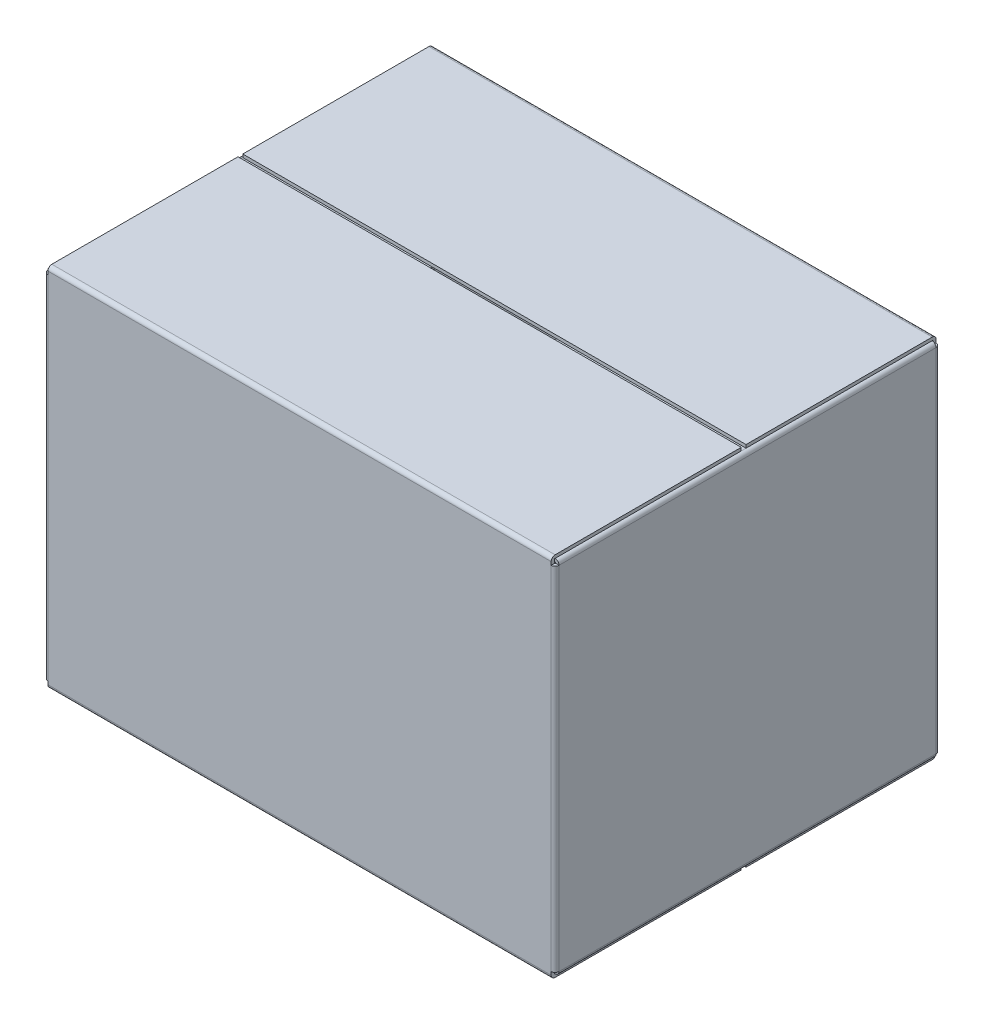
from build123d import *

# Parameters (mm, degrees)
EXTRUDE1_DEPTH      = 177.8
CUT_EXTRUDE1_DEPTH  = 0.79375
CUT_EXTRUDE2_START  = -0.79375
CUT_EXTRUDE2_DEPTH  = 0.79375
EXTRUDE2_DEPTH      = 189.70625
EXTRUDE2_DEPTH_BACK = 189.70625
EXTRUDE3_DEPTH      = 253.20625
EXTRUDE3_DEPTH_BACK = 253.20625
CUT_EXTRUDE3_DEPTH  = 0.00254
SCALE1_SCALE        = 0.5
SCALE2_SCALE        = 0.9
SCALE3_SCALE        = 0.5
SCALE4_SCALE        = 0.5
SCALE5_SCALE        = 0.2
SCALE6_SCALE        = 3
SCALE7_SCALE        = 0.75


with BuildPart() as part:
    # Sketch1 → Extrude1 (new, symmetric)
    with BuildSketch(Plane(origin=(0, 0, 0), x_dir=(1, 0, 0), z_dir=(0, 1, 0))):
        with BuildLine():
            Line((257.175, -189.70625), (257.175, 189.70625))
            ThreePointArc((257.175, 189.70625), (256.012580038, 192.512580038), (253.20625, 193.675))
            Line((253.20625, 193.675), (-253.20625, 193.675))
            ThreePointArc((-253.20625, 193.675), (-256.012580038, 192.512580038), (-257.175, 189.70625))
            Line((-257.175, 189.70625), (-257.175, -189.70625))
            ThreePointArc((-257.175, -189.70625), (-256.012580038, -192.512580038), (-253.20625, -193.675))
            Line((-253.20625, -193.675), (253.20625, -193.675))
            ThreePointArc((253.20625, -193.675), (256.012580038, -192.512580038), (257.175, -189.70625))
        make_face()
        with BuildLine():
            Line((-253.20625, -190.5), (253.20625, -190.5))
            ThreePointArc((253.20625, -190.5), (253.767516008, -190.267516008), (254, -189.70625))
            Line((254, -189.70625), (254, 189.70625))
            ThreePointArc((254, 189.70625), (253.767516008, 190.267516008), (253.20625, 190.5))
            Line((253.20625, 190.5), (-253.20625, 190.5))
            ThreePointArc((-253.20625, 190.5), (-253.767516008, 190.267516008), (-254, 189.70625))
            Line((-254, 189.70625), (-254, -189.70625))
            ThreePointArc((-254, -189.70625), (-253.767516008, -190.267516008), (-253.20625, -190.5))
        make_face(mode=Mode.SUBTRACT)
    extrude(amount=EXTRUDE1_DEPTH, both=True)

    # Sketch2 → Cut-Extrude1 (cut)
    with BuildSketch(Plane(origin=(0, 177.8, 0), x_dir=(1, 0, 0), z_dir=(0, 1, 0))):
        with BuildLine():
            Line((257.175, -189.70625), (257.175, 189.70625))
            ThreePointArc((257.175, 189.70625), (256.012580038, 192.512580038), (253.20625, 193.675))
            Line((253.20625, 193.675), (-253.20625, 193.675))
            ThreePointArc((-253.20625, 193.675), (-256.012580038, 192.512580038), (-257.175, 189.70625))
            Line((-257.175, 189.70625), (-257.175, -189.70625))
            ThreePointArc((-257.175, -189.70625), (-256.012580038, -192.512580038), (-253.20625, -193.675))
            Line((-253.20625, -193.675), (253.20625, -193.675))
            ThreePointArc((253.20625, -193.675), (256.012580038, -192.512580038), (257.175, -189.70625))
        make_face()
    extrude(amount=-CUT_EXTRUDE1_DEPTH, mode=Mode.SUBTRACT)

    # Sketch3 → Cut-Extrude2 (cut)
    with BuildSketch(Plane.XZ.offset(177.8).offset(CUT_EXTRUDE2_START)):
        with BuildLine():
            Line((253.20625, 193.675), (-253.20625, 193.675))
            ThreePointArc((-253.20625, 193.675), (-256.012580038, 192.512580038), (-257.175, 189.70625))
            Line((-257.175, 189.70625), (-257.175, -189.70625))
            ThreePointArc((-257.175, -189.70625), (-256.012580038, -192.512580038), (-253.20625, -193.675))
            Line((-253.20625, -193.675), (253.20625, -193.675))
            ThreePointArc((253.20625, -193.675), (256.012580038, -192.512580038), (257.175, -189.70625))
            Line((257.175, -189.70625), (257.175, 189.70625))
            ThreePointArc((257.175, 189.70625), (256.012580038, 192.512580038), (253.20625, 193.675))
        make_face()
    extrude(amount=CUT_EXTRUDE2_DEPTH, mode=Mode.SUBTRACT)

    # Sketch4 → Extrude2 (add, two sides: drawn at the far end of the back side and taken through both)
    with BuildSketch(Plane.XY.offset(-EXTRUDE2_DEPTH_BACK)):
        with BuildLine():
            Line((-257.175, 177.00625), (-254, 177.00625))
            ThreePointArc((-254, 177.00625), (-253.767516008, 177.567516008), (-253.20625, 177.8))
            Line((-253.20625, 177.8), (-62.70625, 177.8))
            Line((-62.70625, 177.8), (-62.70625, 180.975))
            Line((-62.70625, 180.975), (-253.20625, 180.975))
            ThreePointArc((-253.20625, 180.975), (-256.012580038, 179.812580038), (-257.175, 177.00625))
        make_face()
        with BuildLine():
            Line((62.70625, 177.8), (62.70625, 180.975))
            Line((62.70625, 180.975), (253.20625, 180.975))
            ThreePointArc((253.20625, 180.975), (256.012580038, 179.812580038), (257.175, 177.00625))
            Line((257.175, 177.00625), (254, 177.00625))
            ThreePointArc((254, 177.00625), (253.767516008, 177.567516008), (253.20625, 177.8))
            Line((253.20625, 177.8), (62.70625, 177.8))
        make_face()
        with BuildLine():
            Line((257.175, -177.00625), (254, -177.00625))
            ThreePointArc((254, -177.00625), (253.767516008, -177.567516008), (253.20625, -177.8))
            Line((253.20625, -177.8), (62.70625, -177.8))
            Line((62.70625, -177.8), (62.70625, -180.975))
            Line((62.70625, -180.975), (253.20625, -180.975))
            ThreePointArc((253.20625, -180.975), (256.012580038, -179.812580038), (257.175, -177.00625))
        make_face()
        with BuildLine():
            Line((-62.70625, -177.8), (-62.70625, -180.975))
            Line((-62.70625, -180.975), (-253.20625, -180.975))
            ThreePointArc((-253.20625, -180.975), (-256.012580038, -179.812580038), (-257.175, -177.00625))
            Line((-257.175, -177.00625), (-254, -177.00625))
            ThreePointArc((-254, -177.00625), (-253.767516008, -177.567516008), (-253.20625, -177.8))
            Line((-253.20625, -177.8), (-62.70625, -177.8))
        make_face()
    extrude(amount=EXTRUDE2_DEPTH + EXTRUDE2_DEPTH_BACK)

    # Sketch5 → Extrude3 (add, two sides: drawn at the far end of the back side and taken through both)
    with BuildSketch(Plane(origin=(0, 0, 0), x_dir=(0, 0, -1), z_dir=(1, 0, 0)).offset(-EXTRUDE3_DEPTH_BACK)):
        with BuildLine():
            Line((-193.675, 177.00625), (-190.5, 177.00625))
            Line((-190.5, 177.00625), (-190.5, 180.20665))
            ThreePointArc((-190.5, 180.20665), (-190.267516008, 180.767916008), (-189.70625, 181.0004))
            Line((-189.70625, 181.0004), (-2.40665, 181.0004))
            Line((-2.40665, 181.0004), (-2.40665, 184.1754))
            Line((-2.40665, 184.1754), (-189.70625, 184.1754))
            ThreePointArc((-189.70625, 184.1754), (-192.512580038, 183.012980038), (-193.675, 180.20665))
            Line((-193.675, 180.20665), (-193.675, 177.00625))
        make_face()
        with BuildLine():
            Line((2.40665, 181.0004), (2.40665, 184.1754))
            Line((2.40665, 184.1754), (189.70625, 184.1754))
            ThreePointArc((189.70625, 184.1754), (192.512580038, 183.012980038), (193.675, 180.20665))
            Line((193.675, 180.20665), (193.675, 177.00625))
            Line((193.675, 177.00625), (190.5, 177.00625))
            Line((190.5, 177.00625), (190.5, 180.20665))
            ThreePointArc((190.5, 180.20665), (190.267516008, 180.767916008), (189.70625, 181.0004))
            Line((189.70625, 181.0004), (2.40665, 181.0004))
        make_face()
        with BuildLine():
            Line((193.675, -177.00625), (190.5, -177.00625))
            Line((190.5, -177.00625), (190.5, -180.20665))
            ThreePointArc((190.5, -180.20665), (190.267516008, -180.767916008), (189.70625, -181.0004))
            Line((189.70625, -181.0004), (2.40665, -181.0004))
            Line((2.40665, -181.0004), (2.40665, -184.1754))
            Line((2.40665, -184.1754), (189.70625, -184.1754))
            ThreePointArc((189.70625, -184.1754), (192.512580038, -183.012980038), (193.675, -180.20665))
            Line((193.675, -180.20665), (193.675, -177.00625))
        make_face()
        with BuildLine():
            Line((-2.40665, -181.0004), (-2.40665, -184.1754))
            Line((-2.40665, -184.1754), (-189.70625, -184.1754))
            ThreePointArc((-189.70625, -184.1754), (-192.512580038, -183.012980038), (-193.675, -180.20665))
            Line((-193.675, -180.20665), (-193.675, -177.00625))
            Line((-193.675, -177.00625), (-190.5, -177.00625))
            Line((-190.5, -177.00625), (-190.5, -180.20665))
            ThreePointArc((-190.5, -180.20665), (-190.267516008, -180.767916008), (-189.70625, -181.0004))
            Line((-189.70625, -181.0004), (-2.40665, -181.0004))
        make_face()
    extrude(amount=EXTRUDE3_DEPTH + EXTRUDE3_DEPTH_BACK)

    # Sketch6 → Cut-Extrude3 (cut)
    # profile 1 of 9: a face of its own
    with BuildSketch(Plane.XZ.offset(184.1754)):
        Polygon((-53.463701299, -34.15665), (-53.463701299, -30.198208442), (-59.896168831, -30.198208442), (-59.896168831, -26.993571672), (-53.07713474, -15.10665), (-50.49487013, -15.10665), (-50.49487013, -26.981974675), (-48.515649351, -26.981974675), (-48.515649351, -30.198208442), (-50.49487013, -30.198208442), (-50.49487013, -34.15665), align=None)
        Polygon((-53.463701299, -26.981974675), (-53.463701299, -20.584298133), (-57.070367289, -26.981974675), align=None, mode=Mode.SUBTRACT)
    # profile 2 of 9: a face of its own
    with BuildSketch(Plane.XZ.offset(184.1754)):
        with BuildLine():
            add(Edge.make_bspline(
                [(-40.754939123, -15.10665), (-40.570213815, -15.113439719), (-40.205710774, -15.126837305), (-39.673890769, -15.229837619), (-39.16759988, -15.397175732), (-38.690336025, -15.634564912), (-38.241807619, -15.940319252), (-37.820887787, -16.312573778), (-37.427246646, -16.751168966), (-37.058352638, -17.260041231), (-36.726852287, -17.855192892), (-36.443728617, -18.547334171), (-36.205951404, -19.338854827), (-36.012197536, -20.229658899), (-35.858498426, -21.221012003), (-35.754411409, -22.313004996), (-35.688142013, -23.504633185), (-35.6797945, -24.332609546), (-35.675454545, -24.76308263)],
                knots=[0, 0, 0, 0, 0.727503026, 1.435521033, 2.125933754, 2.823035237, 3.52857293, 4.258887692, 5.031802202, 5.846339271, 6.730577678, 7.709342118, 8.787052798, 9.983216815, 11.298799232, 12.737663191, 14.303878888, 16, 16, 16, 16], degree=3))
            add(Edge.make_bspline(
                [(-35.675454545, -24.76308263), (-35.679804001, -25.19226537), (-35.688168807, -26.017662946), (-35.754290314, -27.205457565), (-35.858961902, -28.29476851), (-36.011412411, -29.283818667), (-36.207491687, -30.173977699), (-36.441916756, -30.965330041), (-36.728001686, -31.656291243), (-37.057995192, -32.250921682), (-37.427573619, -32.75810723), (-37.816928404, -33.199337716), (-38.238059523, -33.570367504), (-38.685731216, -33.874972989), (-39.160661677, -34.11458922), (-39.663898252, -34.27951438), (-40.192649551, -34.384617762), (-40.554706834, -34.39748568), (-40.739476461, -34.404052597)],
                knots=[0, 0, 0, 0, 1.695059366, 3.259911835, 4.697127445, 6.015833273, 7.209868934, 8.295006778, 9.271397414, 10.15773515, 10.974206064, 11.745554658, 12.477603308, 13.184816065, 13.879016739, 14.571068615, 15.270769761, 16, 16, 16, 16], degree=3))
            add(Edge.make_bspline(
                [(-40.739476461, -34.404052597), (-40.924123079, -34.396829155), (-41.288235032, -34.382584964), (-41.820957697, -34.285911247), (-42.326881985, -34.117245621), (-42.802950964, -33.879646109), (-43.25263977, -33.578516507), (-43.673344606, -33.209770375), (-44.067516895, -32.775405993), (-44.367181725, -32.362029715), (-44.592508841, -31.996567754), (-44.749696096, -31.690886587), (-44.8962012, -31.359822775), (-45.037218995, -31.005246866), (-45.158055902, -30.620221885), (-45.274627597, -30.212049593), (-45.37927173, -29.777456024), (-45.469564467, -29.317788043), (-45.557859678, -28.834015634), (-45.623490762, -28.322595423), (-45.68843138, -27.787020617), (-45.731523226, -27.223216721), (-45.771868975, -26.635740381), (-45.796724509, -26.020847658), (-45.819044938, -25.381748378), (-45.81898933, -24.946079677), (-45.818961039, -24.724425974)],
                knots=[0, 0, 0, 0, 1.088325032, 2.146111092, 3.178950023, 4.221795161, 5.273015815, 6.360545385, 7.511177693, 8.723556364, 9.364476831, 10.040531105, 10.747741516, 11.498134997, 12.288409729, 13.125171687, 14.000253567, 14.922333743, 15.886381247, 16.898284178, 17.961049106, 19.066181515, 20.23079341, 21.432081124, 22.693528529, 24, 24, 24, 24], degree=3))
            add(Edge.make_bspline(
                [(-45.818961039, -24.724425974), (-45.814624189, -24.296529395), (-45.80628461, -23.473702547), (-45.740018957, -22.289796723), (-45.635983662, -21.205518181), (-45.481989927, -20.220624943), (-45.28773748, -19.333908442), (-45.051694198, -18.544329196), (-44.766490572, -17.854388781), (-44.436402382, -17.259786218), (-44.066846344, -16.752594079), (-43.677486099, -16.3113652), (-43.256356334, -15.940335013), (-42.808684298, -15.635729629), (-42.333753926, -15.396113372), (-41.830517327, -15.231188219), (-41.301766035, -15.126084835), (-40.939708751, -15.113216917), (-40.754939123, -15.10665)],
                knots=[0, 0, 0, 0, 1.69316225, 3.255878705, 4.690734649, 6.001855936, 7.198146525, 8.280455951, 9.258690493, 10.146702072, 10.964714887, 11.737520167, 12.470951286, 13.179499609, 13.875011277, 14.568370088, 15.269392615, 16, 16, 16, 16], degree=3))
        make_face()
        with BuildLine():
            add(Edge.make_bspline(
                [(-40.747207792, -18.075481169), (-40.81586281, -18.079430076), (-40.952723201, -18.087302029), (-41.151753695, -18.143764517), (-41.34113518, -18.233598401), (-41.517275834, -18.364351037), (-41.678953118, -18.53428757), (-41.834209207, -18.735833596), (-41.976962645, -18.974813246), (-42.11402956, -19.257093676), (-42.230507156, -19.611561254), (-42.333081853, -20.053630124), (-42.413774059, -20.595517785), (-42.481293706, -21.236653428), (-42.539950228, -21.976422127), (-42.575480866, -22.817073491), (-42.599003865, -23.756583703), (-42.601444929, -24.416443876), (-42.602727273, -24.76308263)],
                knots=[0, 0, 0, 0, 0.441180509, 0.879471584, 1.320574249, 1.783035872, 2.281174677, 2.824866155, 3.41612178, 4.06851155, 4.839013556, 5.809909241, 6.984378085, 8.359905701, 9.955928005, 11.756194428, 13.770637572, 16, 16, 16, 16], degree=3))
            add(Edge.make_bspline(
                [(-42.602727273, -24.76308263), (-42.601468062, -25.109722424), (-42.599075714, -25.768296381), (-42.575329699, -26.706506071), (-42.540242905, -27.54461502), (-42.480694446, -28.284297816), (-42.414482069, -28.92429187), (-42.332709206, -29.466061067), (-42.23028581, -29.906760213), (-42.11507657, -30.260551739), (-41.975983573, -30.540606589), (-41.83406873, -30.778541726), (-41.680302525, -30.980343648), (-41.5159223, -31.146294483), (-41.341286793, -31.277254353), (-41.151714366, -31.36689913), (-40.952733082, -31.423410355), (-40.815866111, -31.43127579), (-40.747207792, -31.435221429)],
                knots=[0, 0, 0, 0, 2.233529834, 4.243438314, 6.047070022, 7.637798311, 9.024151416, 10.192614236, 11.165324842, 11.937267167, 12.583397913, 13.175758788, 13.720466603, 14.213631053, 14.676957167, 15.118884396, 15.557994781, 16, 16, 16, 16], degree=3))
            add(Edge.make_bspline(
                [(-40.747207792, -31.435221429), (-40.677263187, -31.431357691), (-40.539107813, -31.423725994), (-40.338657361, -31.367116906), (-40.149005063, -31.275941879), (-39.969442705, -31.147933423), (-39.809398192, -30.976355523), (-39.650589477, -30.77962119), (-39.514653074, -30.538272798), (-39.376297801, -30.257719534), (-39.259071854, -29.90344821), (-39.163929448, -29.459922901), (-39.074809593, -28.919624689), (-39.009033194, -28.279244106), (-38.955654023, -27.540559709), (-38.918617135, -26.702669484), (-38.895510123, -25.765710374), (-38.893004708, -25.108430805), (-38.891688312, -24.76308263)],
                knots=[0, 0, 0, 0, 0.450046871, 0.888937661, 1.330643888, 1.800456046, 2.299276457, 2.837157917, 3.424961576, 4.078244013, 4.849800298, 5.820145492, 6.997538181, 8.374947934, 9.964252522, 11.766982255, 13.775885602, 16, 16, 16, 16], degree=3))
            add(Edge.make_bspline(
                [(-38.891688312, -24.76308263), (-38.893015097, -24.416446455), (-38.89554076, -23.756591192), (-38.91849617, -22.817048039), (-38.955847304, -21.976599532), (-39.008826095, -21.236598506), (-39.074822194, -20.594941875), (-39.163937025, -20.05465354), (-39.259042337, -19.611096797), (-39.376379836, -19.256912214), (-39.51440713, -18.976105382), (-39.651885809, -18.734672693), (-39.80810206, -18.534627735), (-39.969587748, -18.362881793), (-40.148969714, -18.234733271), (-40.338666468, -18.143592762), (-40.539105475, -18.086974788), (-40.677262401, -18.079344296), (-40.747207792, -18.075481169)],
                knots=[0, 0, 0, 0, 2.228036839, 4.241282185, 6.040478161, 7.634927745, 9.009637465, 10.184722199, 11.153165298, 11.923209159, 12.575211015, 13.161862447, 13.705230643, 14.203073253, 14.671964473, 15.112804857, 15.550835322, 16, 16, 16, 16], degree=3))
        make_face(mode=Mode.SUBTRACT)
    # profile 3 of 9: a face of its own
    with BuildSketch(Plane.XZ.offset(184.1754)):
        with BuildLine():
            add(Edge.make_bspline(
                [(-27.172536526, -15.10665), (-26.987811218, -15.113439719), (-26.623308177, -15.126837305), (-26.091488171, -15.229837619), (-25.585197282, -15.397175732), (-25.107933428, -15.634564912), (-24.659405022, -15.940319252), (-24.23848519, -16.312573778), (-23.844844049, -16.751168966), (-23.475950041, -17.260041231), (-23.144449689, -17.855192892), (-22.861326019, -18.547334171), (-22.623548807, -19.338854827), (-22.429794939, -20.229658899), (-22.276095829, -21.221012003), (-22.172008811, -22.313004996), (-22.105739415, -23.504633185), (-22.097391902, -24.332609546), (-22.093051948, -24.76308263)],
                knots=[0, 0, 0, 0, 0.727503026, 1.435521033, 2.125933754, 2.823035237, 3.52857293, 4.258887692, 5.031802202, 5.846339271, 6.730577678, 7.709342118, 8.787052798, 9.983216815, 11.298799232, 12.737663191, 14.303878888, 16, 16, 16, 16], degree=3))
            add(Edge.make_bspline(
                [(-22.093051948, -24.76308263), (-22.097401404, -25.19226537), (-22.105766209, -26.017662946), (-22.171887717, -27.205457565), (-22.276559304, -28.29476851), (-22.429009813, -29.283818667), (-22.625089089, -30.173977699), (-22.859514159, -30.965330041), (-23.145599089, -31.656291243), (-23.475592595, -32.250921682), (-23.845171022, -32.75810723), (-24.234525807, -33.199337716), (-24.655656925, -33.570367504), (-25.103328618, -33.874972989), (-25.578259079, -34.11458922), (-26.081495655, -34.27951438), (-26.610246953, -34.384617762), (-26.972304237, -34.39748568), (-27.157073864, -34.404052597)],
                knots=[0, 0, 0, 0, 1.695059366, 3.259911835, 4.697127445, 6.015833273, 7.209868934, 8.295006778, 9.271397414, 10.15773515, 10.974206064, 11.745554658, 12.477603308, 13.184816065, 13.879016739, 14.571068615, 15.270769761, 16, 16, 16, 16], degree=3))
            add(Edge.make_bspline(
                [(-27.157073864, -34.404052597), (-27.341720481, -34.396829155), (-27.705832435, -34.382584964), (-28.2385551, -34.285911247), (-28.744479388, -34.117245621), (-29.220548366, -33.879646109), (-29.670237172, -33.578516507), (-30.090942008, -33.209770375), (-30.485114297, -32.775405993), (-30.784779127, -32.362029715), (-31.010106244, -31.996567754), (-31.167293498, -31.690886587), (-31.313798603, -31.359822775), (-31.454816398, -31.005246866), (-31.575653305, -30.620221885), (-31.692224999, -30.212049593), (-31.796869133, -29.777456024), (-31.88716187, -29.317788043), (-31.975457081, -28.834015634), (-32.041088164, -28.322595423), (-32.106028783, -27.787020617), (-32.149120628, -27.223216721), (-32.189466378, -26.635740381), (-32.214321911, -26.020847658), (-32.23664234, -25.381748378), (-32.236586733, -24.946079677), (-32.236558442, -24.724425974)],
                knots=[0, 0, 0, 0, 1.088325032, 2.146111092, 3.178950023, 4.221795161, 5.273015815, 6.360545385, 7.511177693, 8.723556364, 9.364476831, 10.040531105, 10.747741516, 11.498134997, 12.288409729, 13.125171687, 14.000253567, 14.922333743, 15.886381247, 16.898284178, 17.961049106, 19.066181515, 20.23079341, 21.432081124, 22.693528529, 24, 24, 24, 24], degree=3))
            add(Edge.make_bspline(
                [(-32.236558442, -24.724425974), (-32.232221591, -24.296529395), (-32.223882013, -23.473702547), (-32.15761636, -22.289796723), (-32.053581064, -21.205518181), (-31.899587329, -20.220624943), (-31.705334882, -19.333908442), (-31.4692916, -18.544329196), (-31.184087974, -17.854388781), (-30.853999785, -17.259786218), (-30.484443747, -16.752594079), (-30.095083501, -16.3113652), (-29.673953737, -15.940335013), (-29.226281701, -15.635729629), (-28.751351329, -15.396113372), (-28.24811473, -15.231188219), (-27.719363438, -15.126084835), (-27.357306153, -15.113216917), (-27.172536526, -15.10665)],
                knots=[0, 0, 0, 0, 1.69316225, 3.255878705, 4.690734649, 6.001855936, 7.198146525, 8.280455951, 9.258690493, 10.146702072, 10.964714887, 11.737520167, 12.470951286, 13.179499609, 13.875011277, 14.568370088, 15.269392615, 16, 16, 16, 16], degree=3))
        make_face()
        with BuildLine():
            add(Edge.make_bspline(
                [(-27.164805195, -18.075481169), (-27.233460212, -18.079430076), (-27.370320603, -18.087302029), (-27.569351098, -18.143764517), (-27.758732582, -18.233598401), (-27.934873236, -18.364351037), (-28.09655052, -18.53428757), (-28.251806609, -18.735833596), (-28.394560048, -18.974813246), (-28.531626963, -19.257093676), (-28.648104558, -19.611561254), (-28.750679256, -20.053630124), (-28.831371462, -20.595517785), (-28.898891109, -21.236653428), (-28.957547631, -21.976422127), (-28.993078269, -22.817073491), (-29.016601268, -23.756583703), (-29.019042332, -24.416443876), (-29.020324675, -24.76308263)],
                knots=[0, 0, 0, 0, 0.441180509, 0.879471584, 1.320574249, 1.783035872, 2.281174677, 2.824866155, 3.41612178, 4.06851155, 4.839013556, 5.809909241, 6.984378085, 8.359905701, 9.955928005, 11.756194428, 13.770637572, 16, 16, 16, 16], degree=3))
            add(Edge.make_bspline(
                [(-29.020324675, -24.76308263), (-29.019065465, -25.109722424), (-29.016673117, -25.768296381), (-28.992927101, -26.706506071), (-28.957840308, -27.54461502), (-28.898291849, -28.284297816), (-28.832079472, -28.92429187), (-28.750306608, -29.466061067), (-28.647883212, -29.906760213), (-28.532673972, -30.260551739), (-28.393580976, -30.540606589), (-28.251666133, -30.778541726), (-28.097899927, -30.980343648), (-27.933519703, -31.146294483), (-27.758884196, -31.277254353), (-27.569311769, -31.36689913), (-27.370330485, -31.423410355), (-27.233463513, -31.43127579), (-27.164805195, -31.435221429)],
                knots=[0, 0, 0, 0, 2.233529834, 4.243438314, 6.047070022, 7.637798311, 9.024151416, 10.192614236, 11.165324842, 11.937267167, 12.583397913, 13.175758788, 13.720466603, 14.213631053, 14.676957167, 15.118884396, 15.557994781, 16, 16, 16, 16], degree=3))
            add(Edge.make_bspline(
                [(-27.164805195, -31.435221429), (-27.09486059, -31.431357691), (-26.956705216, -31.423725994), (-26.756254764, -31.367116906), (-26.566602466, -31.275941879), (-26.387040108, -31.147933423), (-26.226995595, -30.976355523), (-26.06818688, -30.77962119), (-25.932250476, -30.538272798), (-25.793895204, -30.257719534), (-25.676669257, -29.90344821), (-25.581526851, -29.459922901), (-25.492406996, -28.919624689), (-25.426630596, -28.279244106), (-25.373251425, -27.540559709), (-25.336214538, -26.702669484), (-25.313107526, -25.765710374), (-25.310602111, -25.108430805), (-25.309285714, -24.76308263)],
                knots=[0, 0, 0, 0, 0.450046871, 0.888937661, 1.330643888, 1.800456046, 2.299276457, 2.837157917, 3.424961576, 4.078244013, 4.849800298, 5.820145492, 6.997538181, 8.374947934, 9.964252522, 11.766982255, 13.775885602, 16, 16, 16, 16], degree=3))
            add(Edge.make_bspline(
                [(-25.309285714, -24.76308263), (-25.310612499, -24.416446455), (-25.313138163, -23.756591192), (-25.336093573, -22.817048039), (-25.373444706, -21.976599532), (-25.426423498, -21.236598506), (-25.492419597, -20.594941875), (-25.581534427, -20.05465354), (-25.676639739, -19.611096797), (-25.793977238, -19.256912214), (-25.932004532, -18.976105382), (-26.069483211, -18.734672693), (-26.225699462, -18.534627735), (-26.387185151, -18.362881793), (-26.566567117, -18.234733271), (-26.75626387, -18.143592762), (-26.956702877, -18.086974788), (-27.094859804, -18.079344296), (-27.164805195, -18.075481169)],
                knots=[0, 0, 0, 0, 2.228036839, 4.241282185, 6.040478161, 7.634927745, 9.009637465, 10.184722199, 11.153165298, 11.923209159, 12.575211015, 13.161862447, 13.705230643, 14.203073253, 14.671964473, 15.112804857, 15.550835322, 16, 16, 16, 16], degree=3))
        make_face(mode=Mode.SUBTRACT)
    # profile 4 of 9: a face of its own
    with BuildSketch(Plane.XZ.offset(184.1754)):
        with BuildLine():
            add(Edge.make_bspline(
                [(-13.590133929, -15.10665), (-13.40540862, -15.113439719), (-13.040905579, -15.126837305), (-12.509085574, -15.229837619), (-12.002794685, -15.397175732), (-11.525530831, -15.634564912), (-11.077002424, -15.940319252), (-10.656082593, -16.312573778), (-10.262441451, -16.751168966), (-9.893547443, -17.260041231), (-9.562047092, -17.855192892), (-9.278923422, -18.547334171), (-9.041146209, -19.338854827), (-8.847392341, -20.229658899), (-8.693693231, -21.221012003), (-8.589606214, -22.313004996), (-8.523336818, -23.504633185), (-8.514989305, -24.332609546), (-8.510649351, -24.76308263)],
                knots=[0, 0, 0, 0, 0.727503026, 1.435521033, 2.125933754, 2.823035237, 3.52857293, 4.258887692, 5.031802202, 5.846339271, 6.730577678, 7.709342118, 8.787052798, 9.983216815, 11.298799232, 12.737663191, 14.303878888, 16, 16, 16, 16], degree=3))
            add(Edge.make_bspline(
                [(-8.510649351, -24.76308263), (-8.514998806, -25.19226537), (-8.523363612, -26.017662946), (-8.58948512, -27.205457565), (-8.694156707, -28.29476851), (-8.846607216, -29.283818667), (-9.042686492, -30.173977699), (-9.277111561, -30.965330041), (-9.563196491, -31.656291243), (-9.893189997, -32.250921682), (-10.262768424, -32.75810723), (-10.65212321, -33.199337716), (-11.073254328, -33.570367504), (-11.520926021, -33.874972989), (-11.995856482, -34.11458922), (-12.499093057, -34.27951438), (-13.027844356, -34.384617762), (-13.389901639, -34.39748568), (-13.574671266, -34.404052597)],
                knots=[0, 0, 0, 0, 1.695059366, 3.259911835, 4.697127445, 6.015833273, 7.209868934, 8.295006778, 9.271397414, 10.15773515, 10.974206064, 11.745554658, 12.477603308, 13.184816065, 13.879016739, 14.571068615, 15.270769761, 16, 16, 16, 16], degree=3))
            add(Edge.make_bspline(
                [(-13.574671266, -34.404052597), (-13.759317884, -34.396829155), (-14.123429838, -34.382584964), (-14.656152503, -34.285911247), (-15.16207679, -34.117245621), (-15.638145769, -33.879646109), (-16.087834575, -33.578516507), (-16.508539411, -33.209770375), (-16.9027117, -32.775405993), (-17.20237653, -32.362029715), (-17.427703646, -31.996567754), (-17.584890901, -31.690886587), (-17.731396006, -31.359822775), (-17.8724138, -31.005246866), (-17.993250707, -30.620221885), (-18.109822402, -30.212049593), (-18.214466535, -29.777456024), (-18.304759273, -29.317788043), (-18.393054484, -28.834015634), (-18.458685567, -28.322595423), (-18.523626185, -27.787020617), (-18.566718031, -27.223216721), (-18.607063781, -26.635740381), (-18.631919314, -26.020847658), (-18.654239743, -25.381748378), (-18.654184135, -24.946079677), (-18.654155844, -24.724425974)],
                knots=[0, 0, 0, 0, 1.088325032, 2.146111092, 3.178950023, 4.221795161, 5.273015815, 6.360545385, 7.511177693, 8.723556364, 9.364476831, 10.040531105, 10.747741516, 11.498134997, 12.288409729, 13.125171687, 14.000253567, 14.922333743, 15.886381247, 16.898284178, 17.961049106, 19.066181515, 20.23079341, 21.432081124, 22.693528529, 24, 24, 24, 24], degree=3))
            add(Edge.make_bspline(
                [(-18.654155844, -24.724425974), (-18.649818994, -24.296529395), (-18.641479416, -23.473702547), (-18.575213762, -22.289796723), (-18.471178467, -21.205518181), (-18.317184732, -20.220624943), (-18.122932285, -19.333908442), (-17.886889003, -18.544329196), (-17.601685377, -17.854388781), (-17.271597187, -17.259786218), (-16.90204115, -16.752594079), (-16.512680904, -16.3113652), (-16.09155114, -15.940335013), (-15.643879103, -15.635729629), (-15.168948732, -15.396113372), (-14.665712133, -15.231188219), (-14.13696084, -15.126084835), (-13.774903556, -15.113216917), (-13.590133929, -15.10665)],
                knots=[0, 0, 0, 0, 1.69316225, 3.255878705, 4.690734649, 6.001855936, 7.198146525, 8.280455951, 9.258690493, 10.146702072, 10.964714887, 11.737520167, 12.470951286, 13.179499609, 13.875011277, 14.568370088, 15.269392615, 16, 16, 16, 16], degree=3))
        make_face()
        with BuildLine():
            add(Edge.make_bspline(
                [(-13.582402597, -18.075481169), (-13.651057615, -18.079430076), (-13.787918006, -18.087302029), (-13.986948501, -18.143764517), (-14.176329985, -18.233598401), (-14.352470639, -18.364351037), (-14.514147923, -18.53428757), (-14.669404012, -18.735833596), (-14.81215745, -18.974813246), (-14.949224365, -19.257093676), (-15.065701961, -19.611561254), (-15.168276658, -20.053630124), (-15.248968865, -20.595517785), (-15.316488511, -21.236653428), (-15.375145033, -21.976422127), (-15.410675671, -22.817073491), (-15.434198671, -23.756583703), (-15.436639735, -24.416443876), (-15.437922078, -24.76308263)],
                knots=[0, 0, 0, 0, 0.441180509, 0.879471584, 1.320574249, 1.783035872, 2.281174677, 2.824866155, 3.41612178, 4.06851155, 4.839013556, 5.809909241, 6.984378085, 8.359905701, 9.955928005, 11.756194428, 13.770637572, 16, 16, 16, 16], degree=3))
            add(Edge.make_bspline(
                [(-15.437922078, -24.76308263), (-15.436662868, -25.109722424), (-15.434270519, -25.768296381), (-15.410524504, -26.706506071), (-15.37543771, -27.54461502), (-15.315889251, -28.284297816), (-15.249676874, -28.92429187), (-15.167904011, -29.466061067), (-15.065480615, -29.906760213), (-14.950271375, -30.260551739), (-14.811178379, -30.540606589), (-14.669263535, -30.778541726), (-14.51549733, -30.980343648), (-14.351117105, -31.146294483), (-14.176481599, -31.277254353), (-13.986909171, -31.36689913), (-13.787927887, -31.423410355), (-13.651060916, -31.43127579), (-13.582402597, -31.435221429)],
                knots=[0, 0, 0, 0, 2.233529834, 4.243438314, 6.047070022, 7.637798311, 9.024151416, 10.192614236, 11.165324842, 11.937267167, 12.583397913, 13.175758788, 13.720466603, 14.213631053, 14.676957167, 15.118884396, 15.557994781, 16, 16, 16, 16], degree=3))
            add(Edge.make_bspline(
                [(-13.582402597, -31.435221429), (-13.512457992, -31.431357691), (-13.374302618, -31.423725994), (-13.173852166, -31.367116906), (-12.984199869, -31.275941879), (-12.804637511, -31.147933423), (-12.644592997, -30.976355523), (-12.485784282, -30.77962119), (-12.349847879, -30.538272798), (-12.211492606, -30.257719534), (-12.094266659, -29.90344821), (-11.999124254, -29.459922901), (-11.910004398, -28.919624689), (-11.844227999, -28.279244106), (-11.790848828, -27.540559709), (-11.753811941, -26.702669484), (-11.730704929, -25.765710374), (-11.728199513, -25.108430805), (-11.726883117, -24.76308263)],
                knots=[0, 0, 0, 0, 0.450046871, 0.888937661, 1.330643888, 1.800456046, 2.299276457, 2.837157917, 3.424961576, 4.078244013, 4.849800298, 5.820145492, 6.997538181, 8.374947934, 9.964252522, 11.766982255, 13.775885602, 16, 16, 16, 16], degree=3))
            add(Edge.make_bspline(
                [(-11.726883117, -24.76308263), (-11.728209902, -24.416446455), (-11.730735565, -23.756591192), (-11.753690975, -22.817048039), (-11.791042109, -21.976599532), (-11.8440209, -21.236598506), (-11.910016999, -20.594941875), (-11.99913183, -20.05465354), (-12.094237142, -19.611096797), (-12.211574641, -19.256912214), (-12.349601935, -18.976105382), (-12.487080614, -18.734672693), (-12.643296865, -18.534627735), (-12.804782553, -18.362881793), (-12.984164519, -18.234733271), (-13.173861273, -18.143592762), (-13.37430028, -18.086974788), (-13.512457206, -18.079344296), (-13.582402597, -18.075481169)],
                knots=[0, 0, 0, 0, 2.228036839, 4.241282185, 6.040478161, 7.634927745, 9.009637465, 10.184722199, 11.153165298, 11.923209159, 12.575211015, 13.161862447, 13.705230643, 14.203073253, 14.671964473, 15.112804857, 15.550835322, 16, 16, 16, 16], degree=3))
        make_face(mode=Mode.SUBTRACT)
    # profile 5 of 9: a face of its own
    with BuildSketch(Plane.XZ.offset(184.1754)):
        with BuildLine():
            add(Edge.make_bspline(
                [(-0.007731331, -15.10665), (0.176993977, -15.113439719), (0.541497018, -15.126837305), (1.073317023, -15.229837619), (1.579607913, -15.397175732), (2.056871767, -15.634564912), (2.505400173, -15.940319252), (2.926320005, -16.312573778), (3.319961146, -16.751168966), (3.688855154, -17.260041231), (4.020355506, -17.855192892), (4.303479175, -18.547334171), (4.541256388, -19.338854827), (4.735010256, -20.229658899), (4.888709366, -21.221012003), (4.992796383, -22.313004996), (5.059065779, -23.504633185), (5.067413292, -24.332609546), (5.071753247, -24.76308263)],
                knots=[0, 0, 0, 0, 0.727503026, 1.435521033, 2.125933754, 2.823035237, 3.52857293, 4.258887692, 5.031802202, 5.846339271, 6.730577678, 7.709342118, 8.787052798, 9.983216815, 11.298799232, 12.737663191, 14.303878888, 16, 16, 16, 16], degree=3))
            add(Edge.make_bspline(
                [(5.071753247, -24.76308263), (5.067403791, -25.19226537), (5.059038985, -26.017662946), (4.992917478, -27.205457565), (4.888245891, -28.29476851), (4.735795381, -29.283818667), (4.539716106, -30.173977699), (4.305291036, -30.965330041), (4.019206106, -31.656291243), (3.6892126, -32.250921682), (3.319634173, -32.75810723), (2.930279388, -33.199337716), (2.509148269, -33.570367504), (2.061476576, -33.874972989), (1.586546116, -34.11458922), (1.08330954, -34.27951438), (0.554558242, -34.384617762), (0.192500958, -34.39748568), (0.007731331, -34.404052597)],
                knots=[0, 0, 0, 0, 1.695059366, 3.259911835, 4.697127445, 6.015833273, 7.209868934, 8.295006778, 9.271397414, 10.15773515, 10.974206064, 11.745554658, 12.477603308, 13.184816065, 13.879016739, 14.571068615, 15.270769761, 16, 16, 16, 16], degree=3))
            add(Edge.make_bspline(
                [(0.007731331, -34.404052597), (-0.176915286, -34.396829155), (-0.54102724, -34.382584964), (-1.073749905, -34.285911247), (-1.579674193, -34.117245621), (-2.055743171, -33.879646109), (-2.505431977, -33.578516507), (-2.926136814, -33.209770375), (-3.320309103, -32.775405993), (-3.619973933, -32.362029715), (-3.845301049, -31.996567754), (-4.002488303, -31.690886587), (-4.148993408, -31.359822775), (-4.290011203, -31.005246866), (-4.41084811, -30.620221885), (-4.527419805, -30.212049593), (-4.632063938, -29.777456024), (-4.722356675, -29.317788043), (-4.810651886, -28.834015634), (-4.876282969, -28.322595423), (-4.941223588, -27.787020617), (-4.984315434, -27.223216721), (-5.024661183, -26.635740381), (-5.049516717, -26.020847658), (-5.071837145, -25.381748378), (-5.071781538, -24.946079677), (-5.071753247, -24.724425974)],
                knots=[0, 0, 0, 0, 1.088325032, 2.146111092, 3.178950023, 4.221795161, 5.273015815, 6.360545385, 7.511177693, 8.723556364, 9.364476831, 10.040531105, 10.747741516, 11.498134997, 12.288409729, 13.125171687, 14.000253567, 14.922333743, 15.886381247, 16.898284178, 17.961049106, 19.066181515, 20.23079341, 21.432081124, 22.693528529, 24, 24, 24, 24], degree=3))
            add(Edge.make_bspline(
                [(-5.071753247, -24.724425974), (-5.067416396, -24.296529395), (-5.059076818, -23.473702547), (-4.992811165, -22.289796723), (-4.88877587, -21.205518181), (-4.734782135, -20.220624943), (-4.540529687, -19.333908442), (-4.304486406, -18.544329196), (-4.01928278, -17.854388781), (-3.68919459, -17.259786218), (-3.319638552, -16.752594079), (-2.930278306, -16.3113652), (-2.509148542, -15.940335013), (-2.061476506, -15.635729629), (-1.586546134, -15.396113372), (-1.083309535, -15.231188219), (-0.554558243, -15.126084835), (-0.192500959, -15.113216917), (-0.007731331, -15.10665)],
                knots=[0, 0, 0, 0, 1.69316225, 3.255878705, 4.690734649, 6.001855936, 7.198146525, 8.280455951, 9.258690493, 10.146702072, 10.964714887, 11.737520167, 12.470951286, 13.179499609, 13.875011277, 14.568370088, 15.269392615, 16, 16, 16, 16], degree=3))
        make_face()
        with BuildLine():
            add(Edge.make_bspline(
                [(0, -18.075481169), (-0.068655017, -18.079430076), (-0.205515408, -18.087302029), (-0.404545903, -18.143764517), (-0.593927388, -18.233598401), (-0.770068041, -18.364351037), (-0.931745325, -18.53428757), (-1.087001415, -18.735833596), (-1.229754853, -18.974813246), (-1.366821768, -19.257093676), (-1.483299363, -19.611561254), (-1.585874061, -20.053630124), (-1.666566267, -20.595517785), (-1.734085914, -21.236653428), (-1.792742436, -21.976422127), (-1.828273074, -22.817073491), (-1.851796073, -23.756583703), (-1.854237137, -24.416443876), (-1.855519481, -24.76308263)],
                knots=[0, 0, 0, 0, 0.441180509, 0.879471584, 1.320574249, 1.783035872, 2.281174677, 2.824866155, 3.41612178, 4.06851155, 4.839013556, 5.809909241, 6.984378085, 8.359905701, 9.955928005, 11.756194428, 13.770637572, 16, 16, 16, 16], degree=3))
            add(Edge.make_bspline(
                [(-1.855519481, -24.76308263), (-1.85426027, -25.109722424), (-1.851867922, -25.768296381), (-1.828121907, -26.706506071), (-1.793035113, -27.54461502), (-1.733486654, -28.284297816), (-1.667274277, -28.92429187), (-1.585501414, -29.466061067), (-1.483078017, -29.906760213), (-1.367868777, -30.260551739), (-1.228775781, -30.540606589), (-1.086860938, -30.778541726), (-0.933094733, -30.980343648), (-0.768714508, -31.146294483), (-0.594079001, -31.277254353), (-0.404506574, -31.36689913), (-0.20552529, -31.423410355), (-0.068658318, -31.43127579), (0, -31.435221429)],
                knots=[0, 0, 0, 0, 2.233529834, 4.243438314, 6.047070022, 7.637798311, 9.024151416, 10.192614236, 11.165324842, 11.937267167, 12.583397913, 13.175758788, 13.720466603, 14.213631053, 14.676957167, 15.118884396, 15.557994781, 16, 16, 16, 16], degree=3))
            add(Edge.make_bspline(
                [(0, -31.435221429), (0.069944605, -31.431357691), (0.208099979, -31.423725994), (0.408550431, -31.367116906), (0.598202729, -31.275941879), (0.777765087, -31.147933423), (0.9378096, -30.976355523), (1.096618315, -30.77962119), (1.232554719, -30.538272798), (1.370909991, -30.257719534), (1.488135938, -29.90344821), (1.583278344, -29.459922901), (1.672398199, -28.919624689), (1.738174598, -28.279244106), (1.791553769, -27.540559709), (1.828590657, -26.702669484), (1.851697669, -25.765710374), (1.854203084, -25.108430805), (1.855519481, -24.76308263)],
                knots=[0, 0, 0, 0, 0.450046871, 0.888937661, 1.330643888, 1.800456046, 2.299276457, 2.837157917, 3.424961576, 4.078244013, 4.849800298, 5.820145492, 6.997538181, 8.374947934, 9.964252522, 11.766982255, 13.775885602, 16, 16, 16, 16], degree=3))
            add(Edge.make_bspline(
                [(1.855519481, -24.76308263), (1.854192695, -24.416446455), (1.851667032, -23.756591192), (1.828711622, -22.817048039), (1.791360489, -21.976599532), (1.738381697, -21.236598506), (1.672385598, -20.594941875), (1.583270767, -20.05465354), (1.488165456, -19.611096797), (1.370827957, -19.256912214), (1.232800663, -18.976105382), (1.095321983, -18.734672693), (0.939105733, -18.534627735), (0.777620044, -18.362881793), (0.598238078, -18.234733271), (0.408541324, -18.143592762), (0.208102317, -18.086974788), (0.069945391, -18.079344296), (0, -18.075481169)],
                knots=[0, 0, 0, 0, 2.228036839, 4.241282185, 6.040478161, 7.634927745, 9.009637465, 10.184722199, 11.153165298, 11.923209159, 12.575211015, 13.161862447, 13.705230643, 14.203073253, 14.671964473, 15.112804857, 15.550835322, 16, 16, 16, 16], degree=3))
        make_face(mode=Mode.SUBTRACT)
    # profile 6 of 9: a face of its own
    with BuildSketch(Plane.XZ.offset(184.1754)):
        with BuildLine():
            Line((16.18012987, -34.15665), (13.211298701, -34.15665))
            Line((13.211298701, -34.15665), (13.211298701, -20.302104545))
            add(Edge.make_bspline(
                [(13.211298701, -20.302104545), (13.067311019, -20.453197017), (12.781749739, -20.752848759), (12.32744278, -21.171173763), (11.857423521, -21.556847693), (11.368590492, -21.911619082), (10.866537099, -22.238855199), (10.344912046, -22.534228926), (9.808138437, -22.798356973), (9.438084555, -22.948420206), (9.252857143, -23.023533117)],
                knots=[0, 0, 0, 0, 1.033480345, 2.049633457, 3.05634389, 4.043072978, 5.039658923, 6.022790494, 7.010324124, 8, 8, 8, 8], degree=3))
            Line((9.252857143, -23.023533117), (9.252857143, -19.807299351))
            add(Edge.make_bspline(
                [(9.252857143, -19.807299351), (9.466359502, -19.712409423), (9.910859346, -19.514853957), (10.561139568, -19.118203694), (11.217896378, -18.621482819), (11.76284264, -18.14466988), (12.187880695, -17.720448586), (12.490735419, -17.386321993), (12.761868484, -17.03340591), (13.013139691, -16.674297876), (13.234995729, -16.29872841), (13.43086359, -15.913907473), (13.604666221, -15.517324802), (13.69532481, -15.244025508), (13.740894886, -15.10665)],
                knots=[0, 0, 0, 0, 1.256071058, 2.615068939, 4.086222451, 5.682781329, 6.506361962, 7.316438188, 8.106904776, 8.89922375, 9.673254088, 10.451495518, 11.221635059, 12, 12, 12, 12], degree=3))
            Line((13.740894886, -15.10665), (16.18012987, -15.10665))
            Line((16.18012987, -15.10665), (16.18012987, -34.15665))
        make_face()
    # profile 7 of 9: a face of its own
    with BuildSketch(Plane.XZ.offset(184.1754)):
        with BuildLine():
            Line((29.762532468, -34.15665), (26.793701299, -34.15665))
            Line((26.793701299, -34.15665), (26.793701299, -20.302104545))
            add(Edge.make_bspline(
                [(26.793701299, -20.302104545), (26.649713617, -20.453197017), (26.364152337, -20.752848759), (25.909845378, -21.171173763), (25.439826118, -21.556847693), (24.95099309, -21.911619082), (24.448939696, -22.238855199), (23.927314643, -22.534228926), (23.390541035, -22.798356973), (23.020487153, -22.948420206), (22.83525974, -23.023533117)],
                knots=[0, 0, 0, 0, 1.033480345, 2.049633457, 3.05634389, 4.043072978, 5.039658923, 6.022790494, 7.010324124, 8, 8, 8, 8], degree=3))
            Line((22.83525974, -23.023533117), (22.83525974, -19.807299351))
            add(Edge.make_bspline(
                [(22.83525974, -19.807299351), (23.0487621, -19.712409423), (23.493261944, -19.514853957), (24.143542165, -19.118203694), (24.800298975, -18.621482819), (25.345245237, -18.14466988), (25.770283292, -17.720448586), (26.073138016, -17.386321993), (26.344271081, -17.03340591), (26.595542288, -16.674297876), (26.817398327, -16.29872841), (27.013266188, -15.913907473), (27.187068819, -15.517324802), (27.277727408, -15.244025508), (27.323297484, -15.10665)],
                knots=[0, 0, 0, 0, 1.256071058, 2.615068939, 4.086222451, 5.682781329, 6.506361962, 7.316438188, 8.106904776, 8.89922375, 9.673254088, 10.451495518, 11.221635059, 12, 12, 12, 12], degree=3))
            Line((27.323297484, -15.10665), (29.762532468, -15.10665))
            Line((29.762532468, -15.10665), (29.762532468, -34.15665))
        make_face()
    # profile 8 of 9: a face of its own
    with BuildSketch(Plane.XZ.offset(184.1754)):
        with BuildLine():
            Line((35.675454545, -29.208598052), (38.644285714, -28.713792857))
            add(Edge.make_bspline(
                [(38.644285714, -28.713792857), (38.669608885, -28.91456041), (38.718174885, -29.299602111), (38.877465464, -29.838662834), (39.102656679, -30.311438291), (39.391495006, -30.711151884), (39.726767292, -31.024886874), (40.078764085, -31.263326793), (40.455786288, -31.407129358), (40.715147934, -31.425904667), (40.843849432, -31.435221429)],
                knots=[0, 0, 0, 0, 1.267913931, 2.431666527, 3.509083407, 4.539057175, 5.505497605, 6.375431844, 7.193850133, 8, 8, 8, 8], degree=3))
            add(Edge.make_bspline(
                [(40.843849432, -31.435221429), (40.920112209, -31.432180905), (41.069974287, -31.426206049), (41.290337355, -31.380575261), (41.503798945, -31.313530966), (41.706751104, -31.208449231), (41.903963647, -31.082430817), (42.091883578, -30.924909387), (42.268374282, -30.737750706), (42.440356665, -30.525709106), (42.593763871, -30.281484782), (42.730759904, -30.007478773), (42.845439858, -29.7029739), (42.937090471, -29.367435002), (43.011325524, -29.003459903), (43.058874771, -28.609135071), (43.090856949, -28.184719927), (43.095250952, -27.891759909), (43.097532468, -27.73964513)],
                knots=[0, 0, 0, 0, 0.759915694, 1.493291328, 2.23695261, 2.984047812, 3.764651827, 4.567572245, 5.421908294, 6.327020061, 7.285992678, 8.291697758, 9.377615963, 10.524980024, 11.757348812, 13.078695297, 14.4831595, 16, 16, 16, 16], degree=3))
            add(Edge.make_bspline(
                [(43.097532468, -27.73964513), (43.095165128, -27.59655634), (43.090574, -27.319055402), (43.059405939, -26.917685943), (43.010495778, -26.544199575), (42.938893064, -26.199658161), (42.839642488, -25.885768188), (42.730791536, -25.597371786), (42.594426413, -25.338861797), (42.434267302, -25.112934346), (42.266180373, -24.908128813), (42.077156735, -24.73964233), (41.884361433, -24.589695135), (41.676808853, -24.468161852), (41.456699063, -24.375941005), (41.225465026, -24.310919288), (40.984844351, -24.264761877), (40.819592512, -24.26196665), (40.735610795, -24.260546104)],
                knots=[0, 0, 0, 0, 1.452992624, 2.817878434, 4.08552741, 5.276356634, 6.385596521, 7.425606029, 8.403153558, 9.343289966, 10.234624763, 11.086674211, 11.90844429, 12.711882619, 13.521160352, 14.324598681, 15.14855363, 16, 16, 16, 16], degree=3))
            add(Edge.make_bspline(
                [(40.735610795, -24.260546104), (40.628395216, -24.264209527), (40.414961144, -24.271502305), (40.099420791, -24.332029406), (39.791831053, -24.42908732), (39.492308503, -24.565930034), (39.201136798, -24.741676427), (38.918309061, -24.954899017), (38.645915938, -25.209543459), (38.476565933, -25.399505524), (38.389151786, -25.497559091)],
                knots=[0, 0, 0, 0, 0.937869113, 1.867016208, 2.801624103, 3.755632097, 4.742157478, 5.773077042, 6.850519244, 8, 8, 8, 8], degree=3))
            Line((38.389151786, -25.497559091), (35.922857143, -25.002753896))
            Line((35.922857143, -25.002753896), (37.407272727, -15.354052597))
            Line((37.407272727, -15.354052597), (45.571558442, -15.354052597))
            Line((45.571558442, -15.354052597), (45.571558442, -18.570286364))
            Line((45.571558442, -18.570286364), (39.660955763, -18.570286364))
            Line((39.660955763, -18.570286364), (39.131359578, -22.010728734))
            add(Edge.make_bspline(
                [(39.131359578, -22.010728734), (39.307872423, -21.901564794), (39.65107341, -21.689312977), (40.195352304, -21.458665282), (40.745565103, -21.321033313), (41.113709826, -21.301429156), (41.296132305, -21.291714935)],
                knots=[0, 0, 0, 0, 1.075425093, 2.090992046, 3.054051459, 4, 4, 4, 4], degree=3))
            add(Edge.make_bspline(
                [(41.296132305, -21.291714935), (41.456200676, -21.295854464), (41.770174134, -21.303974134), (42.230894743, -21.377500975), (42.674254443, -21.488775683), (43.10146517, -21.645696504), (43.505449617, -21.859348841), (43.892677082, -22.110994066), (44.265387, -22.405262241), (44.487845117, -22.635525451), (44.60127638, -22.752936526)],
                knots=[0, 0, 0, 0, 1.03108493, 2.0224689, 2.999449432, 3.974450981, 4.947717618, 5.938301089, 6.948740945, 8, 8, 8, 8], degree=3))
            add(Edge.make_bspline(
                [(44.60127638, -22.752936526), (44.738993134, -22.911110992), (45.01412422, -23.227112577), (45.361151478, -23.754492977), (45.656389325, -24.316573399), (45.894886278, -24.915959581), (46.088441054, -25.549870734), (46.214387962, -26.224236891), (46.299535438, -26.933413741), (46.30895649, -27.418530243), (46.313766234, -27.666197484)],
                knots=[0, 0, 0, 0, 0.94374017, 1.88540791, 2.835550974, 3.799054059, 4.786896658, 5.815859071, 6.884927323, 8, 8, 8, 8], degree=3))
            add(Edge.make_bspline(
                [(46.313766234, -27.666197484), (46.309098472, -27.873830749), (46.299826682, -28.286262233), (46.232021284, -28.897315407), (46.124481027, -29.497231132), (45.969241853, -30.083610106), (45.771845023, -30.657386161), (45.530208304, -31.218189683), (45.244092755, -31.765698214), (44.919205158, -32.294843801), (44.558860672, -32.791210389), (44.145848057, -33.221192154), (43.700112079, -33.589314608), (43.212709703, -33.886828922), (42.688915595, -34.118982532), (42.126860773, -34.286920523), (41.526228954, -34.383238911), (41.11350162, -34.396996842), (40.901834416, -34.404052597)],
                knots=[0, 0, 0, 0, 1.033439779, 2.052768861, 3.056785634, 4.064973729, 5.069092947, 6.074747595, 7.101857544, 8.141489681, 9.163962361, 10.148467339, 11.101198836, 12.034095725, 12.981717544, 13.945697432, 14.94645097, 16, 16, 16, 16], degree=3))
            add(Edge.make_bspline(
                [(40.901834416, -34.404052597), (40.730201267, -34.401216091), (40.392054512, -34.395627686), (39.895915602, -34.325194084), (39.420014848, -34.224419603), (38.967106275, -34.07517571), (38.535914138, -33.885000134), (38.124852773, -33.65270789), (37.73646713, -33.376534698), (37.373224013, -33.058716151), (37.036751628, -32.703737254), (36.733250939, -32.310389611), (36.465782825, -31.880682549), (36.239431485, -31.412461092), (36.039489481, -30.913797046), (35.884987055, -30.376656544), (35.752733495, -29.80706036), (35.701655469, -29.411502794), (35.675454545, -29.208598052)],
                knots=[0, 0, 0, 0, 1.00857657, 1.987068909, 2.941346578, 3.866350745, 4.785813118, 5.70882856, 6.638199118, 7.583467978, 8.542996637, 9.510036632, 10.500457799, 11.51377743, 12.56495397, 13.65588633, 14.797566218, 16, 16, 16, 16], degree=3))
        make_face()
    # profile 9 of 9: a face of its own
    with BuildSketch(Plane.XZ.offset(184.1754)):
        with BuildLine():
            Line((56.927337662, -34.15665), (53.958506494, -34.15665))
            Line((53.958506494, -34.15665), (53.958506494, -20.302104545))
            add(Edge.make_bspline(
                [(53.958506494, -20.302104545), (53.814518811, -20.453197017), (53.528957531, -20.752848759), (53.074650572, -21.171173763), (52.604631313, -21.556847693), (52.115798285, -21.911619082), (51.613744891, -22.238855199), (51.092119838, -22.534228926), (50.55534623, -22.798356973), (50.185292347, -22.948420206), (50.000064935, -23.023533117)],
                knots=[0, 0, 0, 0, 1.033480345, 2.049633457, 3.05634389, 4.043072978, 5.039658923, 6.022790494, 7.010324124, 8, 8, 8, 8], degree=3))
            Line((50.000064935, -23.023533117), (50.000064935, -19.807299351))
            add(Edge.make_bspline(
                [(50.000064935, -19.807299351), (50.213567295, -19.712409423), (50.658067138, -19.514853957), (51.30834736, -19.118203694), (51.96510417, -18.621482819), (52.510050432, -18.14466988), (52.935088487, -17.720448586), (53.237943211, -17.386321993), (53.509076276, -17.03340591), (53.760347483, -16.674297876), (53.982203522, -16.29872841), (54.178071383, -15.913907473), (54.351874014, -15.517324802), (54.442532602, -15.244025508), (54.488102679, -15.10665)],
                knots=[0, 0, 0, 0, 1.256071058, 2.615068939, 4.086222451, 5.682781329, 6.506361962, 7.316438188, 8.106904776, 8.89922375, 9.673254088, 10.451495518, 11.221635059, 12, 12, 12, 12], degree=3))
            Line((54.488102679, -15.10665), (56.927337662, -15.10665))
            Line((56.927337662, -15.10665), (56.927337662, -34.15665))
        make_face()
    extrude(amount=-CUT_EXTRUDE3_DEPTH, mode=Mode.SUBTRACT)


with BuildPart() as part_1:
    # Scale1: scaled about (0, 0, 0)
    add(part.part.scale(SCALE1_SCALE))


with BuildPart() as part_2:
    # Scale2: scaled about (0, 0, 0)
    add(part_1.part.scale(SCALE2_SCALE))


with BuildPart() as part_3:
    # Scale3: scaled about (0, 0, 0)
    add(part_2.part.scale(SCALE3_SCALE))


with BuildPart() as part_4:
    # Scale4: scaled about (0, 0, 0)
    add(part_3.part.scale(SCALE4_SCALE))


with BuildPart() as part_5:
    # Scale5: scaled about (0, 0, 0)
    add(part_4.part.scale(SCALE5_SCALE))


with BuildPart() as part_6:
    # Scale6: scaled about (0, 0, 0)
    add(part_5.part.scale(SCALE6_SCALE))


with BuildPart() as part_7:
    # Scale7: scaled about (0, 0, 0)
    add(part_6.part.scale(SCALE7_SCALE))


solid = part_7.part
